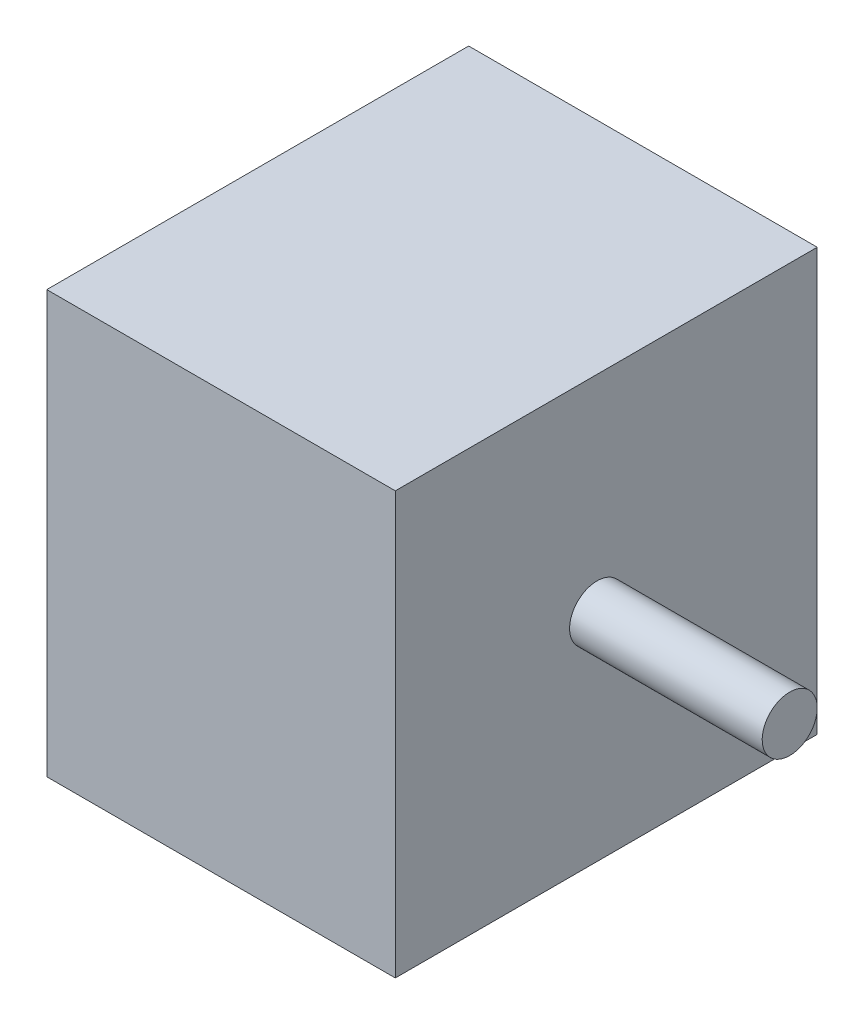
from build123d import *

# Parameters (mm, degrees)
ESQUISSE1_W                   = 44.2
ESQUISSE1_H                   = 52.2
BOSS_EXTRU_1_DEPTH            = 52.2
ENL_V_MAT_EXTRU_2_DEPTH       = 74.209903702
ENL_V_MAT_EXTRU_2_DEPTH_BACK  = 44.2
ENL_V_MAT_EXTRU_3_DEPTH       = 74.209903702
ENL_V_MAT_EXTRU_3_DEPTH_BACK  = 44.2
ENL_V_MAT_EXTRU_4_DEPTH       = 78.059003368
ENL_V_MAT_EXTRU_4_DEPTH_BACK  = 46
ENL_V_MAT_EXTRU_5_DEPTH       = 78.059003368
ENL_V_MAT_EXTRU_5_DEPTH_BACK  = 46
ENL_V_MAT_EXTRU_7_DEPTH       = 45.550224466
ENL_V_MAT_EXTRU_7_DEPTH_BACK  = 45.550224466
ENL_V_MAT_EXTRU_8_DEPTH       = 78.059003368
ENL_V_MAT_EXTRU_8_DEPTH_BACK  = 46
ENL_V_MAT_EXTRU_9_DEPTH       = 75.993733072
ENL_V_MAT_EXTRU_9_DEPTH_BACK  = 46
ESQUISSE13_R                  = 3
BOSS_EXTRU_2_DEPTH            = 21
ENL_V_MAT_EXTRU_10_DEPTH      = 84.625713749
ENL_V_MAT_EXTRU_10_DEPTH_BACK = 49
ENL_V_MAT_EXTRU_11_DEPTH      = 82.074163579
ENL_V_MAT_EXTRU_11_DEPTH_BACK = 49


with BuildPart() as part:
    # Esquisse1 → Boss.-Extru.1 (new body)
    with BuildSketch(Plane.XY):
        Rectangle(ESQUISSE1_W, ESQUISSE1_H)
    extrude(amount=BOSS_EXTRU_1_DEPTH)

    # Esquisse2 → Enlèv. mat.-Extru.2 (cut, two sides: drawn at the far end of the back side and taken through both)
    with BuildSketch(Plane(origin=(22.1, 0, 0), x_dir=(0, 0, -1), z_dir=(1, 0, 0)).offset(-ENL_V_MAT_EXTRU_2_DEPTH_BACK)):
        Polygon((-201.352290675, -19.9), (-52.2, -19.9), (-28.55, -19.9), (-28.55, -21.45), (-32.25, -21.45), (-32.25, -22.45), (-28.745559959, -26.1), (74.553898465, -133.690091099), (-39.180744024, -409.461834307), (-315.086933163, -295.671743208), align=None)
    extrude(amount=ENL_V_MAT_EXTRU_2_DEPTH + ENL_V_MAT_EXTRU_2_DEPTH_BACK, mode=Mode.SUBTRACT)

    # Esquisse3 → Enlèv. mat.-Extru.3 (cut, two sides: drawn at the far end of the back side and taken through both)
    with BuildSketch(Plane(origin=(22.1, 0, 0), x_dir=(0, 0, -1), z_dir=(1, 0, 0)).offset(-ENL_V_MAT_EXTRU_3_DEPTH_BACK)):
        Polygon((149.152290675, -19.9), (0, -19.9), (-23.65, -19.9), (-23.65, -21.45), (-19.95, -21.45), (-19.95, -22.45), (-23.454440041, -26.1), (-126.753898465, -133.690091099), (-13.019255976, -409.461834307), (262.886933163, -295.671743208), align=None)
    extrude(amount=ENL_V_MAT_EXTRU_3_DEPTH + ENL_V_MAT_EXTRU_3_DEPTH_BACK, mode=Mode.SUBTRACT)

    # Esquisse4 → Enlèv. mat.-Extru.4 (cut, two sides: drawn at the far end of the back side and taken through both)
    with BuildSketch(Plane(origin=(0, 26.1, 0), x_dir=(1, 0, 0), z_dir=(0, 1, 0)).offset(-ENL_V_MAT_EXTRU_4_DEPTH_BACK)):
        Polygon((-15.9, -191.333109619), (-15.9, -52.2), (-15.9, -28.55), (-17.45, -28.55), (-17.45, -32.25), (-18.45, -32.25), (-22.1, -28.745559959), (-122.462816227, 67.614843274), (-379.791464965, -38.281593439), (-273.228648738, -297.229546332), align=None)
    extrude(amount=ENL_V_MAT_EXTRU_4_DEPTH + ENL_V_MAT_EXTRU_4_DEPTH_BACK, mode=Mode.SUBTRACT)

    # Esquisse5 → Enlèv. mat.-Extru.5 (cut, two sides: drawn at the far end of the back side and taken through both)
    with BuildSketch(Plane(origin=(0, 26.1, 0), x_dir=(1, 0, 0), z_dir=(0, 1, 0)).offset(-ENL_V_MAT_EXTRU_5_DEPTH_BACK)):
        Polygon((-15.9, 139.133109619), (-15.9, 0), (-15.9, -23.65), (-17.45, -23.65), (-17.45, -19.95), (-18.45, -19.95), (-22.1, -23.454440041), (-122.462816228, -119.814843274), (-379.791464965, -13.918406561), (-273.228648738, 245.029546332), align=None)
    extrude(amount=ENL_V_MAT_EXTRU_5_DEPTH + ENL_V_MAT_EXTRU_5_DEPTH_BACK, mode=Mode.SUBTRACT)

    # Esquisse6 → Enlèv. mat.-Extru.7 (cut, two sides: drawn at the far end of the back side and taken through both)
    with BuildSketch(Plane.XY.offset(28.55).offset(-ENL_V_MAT_EXTRU_7_DEPTH_BACK)):
        Polygon((-161.22284167, -19.9), (-22.1, -19.9), (-15.9, -19.9), (-15.9, -26.093649616), (-15.9, -165.216491285), (-212.645110561, -361.97019968), (-357.967952231, -216.653708395), align=None)
    extrude(amount=ENL_V_MAT_EXTRU_7_DEPTH + ENL_V_MAT_EXTRU_7_DEPTH_BACK, mode=Mode.SUBTRACT)

    # Esquisse11 → Enlèv. mat.-Extru.8 (cut, two sides: drawn at the far end of the back side and taken through both)
    with BuildSketch(Plane(origin=(0, 26.1, 0), x_dir=(1, 0, 0), z_dir=(0, 1, 0)).offset(-ENL_V_MAT_EXTRU_8_DEPTH_BACK)):
        Polygon((164.227968273, -49.1), (22.1, -49.1), (-15.9, -49.1), (-158.027968273, -49.1), (-158.027968273, -333.355936546), (164.227968273, -333.355936546), align=None)
    extrude(amount=ENL_V_MAT_EXTRU_8_DEPTH + ENL_V_MAT_EXTRU_8_DEPTH_BACK, mode=Mode.SUBTRACT)

    # Esquisse12 → Enlèv. mat.-Extru.9 (cut, two sides: drawn at the far end of the back side and taken through both)
    with BuildSketch(Plane(origin=(0, 26.1, 0), x_dir=(1, 0, 0), z_dir=(0, 1, 0)).offset(-ENL_V_MAT_EXTRU_9_DEPTH_BACK)):
        Polygon((159.687460199, -3.1), (22.1, -3.1), (-15.9, -3.1), (-153.487460199, -3.1), (-153.487460199, 272.074920398), (159.687460199, 272.074920398), align=None)
    extrude(amount=ENL_V_MAT_EXTRU_9_DEPTH + ENL_V_MAT_EXTRU_9_DEPTH_BACK, mode=Mode.SUBTRACT)

    # Esquisse13 → Boss.-Extru.2 (add)
    with BuildSketch(Plane(origin=(22.1, 0, 0), x_dir=(0, 0, -1), z_dir=(1, 0, 0))):
        with Locations(Location((-27.1, 3.6, 0), (0, 0, 270))):
            Circle(ESQUISSE13_R)
    extrude(amount=BOSS_EXTRU_2_DEPTH)

    # Esquisse15 → Enlèv. mat.-Extru.10 (cut, two sides: drawn at the far end of the back side and taken through both)
    with BuildSketch(Plane(origin=(0, 26.1, 0), x_dir=(1, 0, 0), z_dir=(0, 1, 0)).offset(-ENL_V_MAT_EXTRU_10_DEPTH_BACK)):
        Polygon((-15.9, 114.859960703), (-15.9, -23.65), (-15.9, -28.55), (-15.9, -167.059960703), (-292.919921407, -167.059960703), (-292.919921407, 114.859960703), align=None)
    extrude(amount=ENL_V_MAT_EXTRU_10_DEPTH + ENL_V_MAT_EXTRU_10_DEPTH_BACK, mode=Mode.SUBTRACT)

    # Esquisse16 → Enlèv. mat.-Extru.11 (cut, two sides: drawn at the far end of the back side and taken through both)
    with BuildSketch(Plane.ZY.offset(15.9).offset(-ENL_V_MAT_EXTRU_11_DEPTH_BACK)):
        Polygon((-91.491856556, -19.9), (23.65, -19.9), (28.55, -19.9), (143.691856556, -19.9), (143.691856556, -250.183713112), (-91.491856556, -250.183713112), align=None)
    extrude(amount=ENL_V_MAT_EXTRU_11_DEPTH + ENL_V_MAT_EXTRU_11_DEPTH_BACK, mode=Mode.SUBTRACT)


solid = part.part
